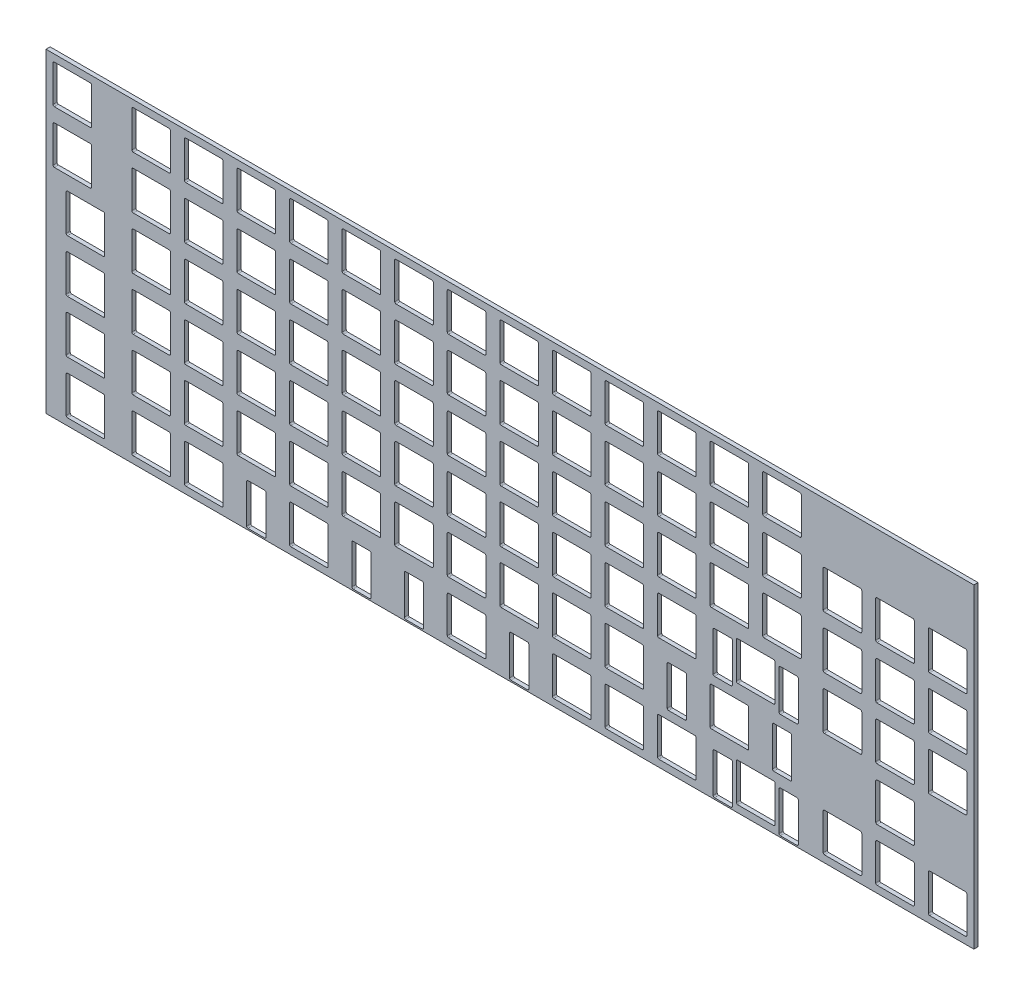
from build123d import *

# Parameters (mm, degrees)
MODEL_W             = 336.2325
MODEL_H             = 114.3
BOSS_EXTRUDE1_DEPTH = 1.5


with BuildPart() as part:
    # Model → Boss-Extrude1 (new body)
    with BuildSketch(Plane.XY):
        with Locations((168.11625, -57.15)):
            Rectangle(MODEL_W, MODEL_H)
        with BuildLine():
            Line((3.025, -2.525), (16.025, -2.525))
            ThreePointArc((16.025, -2.525), (16.378553391, -2.671446609), (16.525, -3.025))
            Line((16.525, -3.025), (16.525, -16.025))
            ThreePointArc((16.525, -16.025), (16.378553391, -16.378553391), (16.025, -16.525))
            Line((16.025, -16.525), (3.025, -16.525))
            ThreePointArc((3.025, -16.525), (2.671446609, -16.378553391), (2.525, -16.025))
            Line((2.525, -16.025), (2.525, -3.025))
            ThreePointArc((2.525, -3.025), (2.671446609, -2.671446609), (3.025, -2.525))
        make_face(mode=Mode.SUBTRACT)
        with BuildLine():
            Line((31.6, -2.525), (44.6, -2.525))
            ThreePointArc((44.6, -2.525), (44.953553391, -2.671446609), (45.1, -3.025))
            Line((45.1, -3.025), (45.1, -16.025))
            ThreePointArc((45.1, -16.025), (44.953553391, -16.378553391), (44.6, -16.525))
            Line((44.6, -16.525), (31.6, -16.525))
            ThreePointArc((31.6, -16.525), (31.246446609, -16.378553391), (31.1, -16.025))
            Line((31.1, -16.025), (31.1, -3.025))
            ThreePointArc((31.1, -3.025), (31.246446609, -2.671446609), (31.6, -2.525))
        make_face(mode=Mode.SUBTRACT)
        with BuildLine():
            Line((50.65, -2.525), (63.65, -2.525))
            ThreePointArc((63.65, -2.525), (64.003553391, -2.671446609), (64.15, -3.025))
            Line((64.15, -3.025), (64.15, -16.025))
            ThreePointArc((64.15, -16.025), (64.003553391, -16.378553391), (63.65, -16.525))
            Line((63.65, -16.525), (50.65, -16.525))
            ThreePointArc((50.65, -16.525), (50.296446609, -16.378553391), (50.15, -16.025))
            Line((50.15, -16.025), (50.15, -3.025))
            ThreePointArc((50.15, -3.025), (50.296446609, -2.671446609), (50.65, -2.525))
        make_face(mode=Mode.SUBTRACT)
        with BuildLine():
            Line((69.7, -2.525), (82.7, -2.525))
            ThreePointArc((82.7, -2.525), (83.053553391, -2.671446609), (83.2, -3.025))
            Line((83.2, -3.025), (83.2, -16.025))
            ThreePointArc((83.2, -16.025), (83.053553391, -16.378553391), (82.7, -16.525))
            Line((82.7, -16.525), (69.7, -16.525))
            ThreePointArc((69.7, -16.525), (69.346446609, -16.378553391), (69.2, -16.025))
            Line((69.2, -16.025), (69.2, -3.025))
            ThreePointArc((69.2, -3.025), (69.346446609, -2.671446609), (69.7, -2.525))
        make_face(mode=Mode.SUBTRACT)
        with BuildLine():
            Line((88.75, -2.525), (101.75, -2.525))
            ThreePointArc((101.75, -2.525), (102.103553391, -2.671446609), (102.25, -3.025))
            Line((102.25, -3.025), (102.25, -16.025))
            ThreePointArc((102.25, -16.025), (102.103553391, -16.378553391), (101.75, -16.525))
            Line((101.75, -16.525), (88.75, -16.525))
            ThreePointArc((88.75, -16.525), (88.396446609, -16.378553391), (88.25, -16.025))
            Line((88.25, -16.025), (88.25, -3.025))
            ThreePointArc((88.25, -3.025), (88.396446609, -2.671446609), (88.75, -2.525))
        make_face(mode=Mode.SUBTRACT)
        with BuildLine():
            Line((107.8, -2.525), (120.8, -2.525))
            ThreePointArc((120.8, -2.525), (121.153553391, -2.671446609), (121.3, -3.025))
            Line((121.3, -3.025), (121.3, -16.025))
            ThreePointArc((121.3, -16.025), (121.153553391, -16.378553391), (120.8, -16.525))
            Line((120.8, -16.525), (107.8, -16.525))
            ThreePointArc((107.8, -16.525), (107.446446609, -16.378553391), (107.3, -16.025))
            Line((107.3, -16.025), (107.3, -3.025))
            ThreePointArc((107.3, -3.025), (107.446446609, -2.671446609), (107.8, -2.525))
        make_face(mode=Mode.SUBTRACT)
        with BuildLine():
            Line((126.85, -2.525), (139.85, -2.525))
            ThreePointArc((139.85, -2.525), (140.203553391, -2.671446609), (140.35, -3.025))
            Line((140.35, -3.025), (140.35, -16.025))
            ThreePointArc((140.35, -16.025), (140.203553391, -16.378553391), (139.85, -16.525))
            Line((139.85, -16.525), (126.85, -16.525))
            ThreePointArc((126.85, -16.525), (126.496446609, -16.378553391), (126.35, -16.025))
            Line((126.35, -16.025), (126.35, -3.025))
            ThreePointArc((126.35, -3.025), (126.496446609, -2.671446609), (126.85, -2.525))
        make_face(mode=Mode.SUBTRACT)
        with BuildLine():
            Line((145.9, -2.525), (158.9, -2.525))
            ThreePointArc((158.9, -2.525), (159.253553391, -2.671446609), (159.4, -3.025))
            Line((159.4, -3.025), (159.4, -16.025))
            ThreePointArc((159.4, -16.025), (159.253553391, -16.378553391), (158.9, -16.525))
            Line((158.9, -16.525), (145.9, -16.525))
            ThreePointArc((145.9, -16.525), (145.546446609, -16.378553391), (145.4, -16.025))
            Line((145.4, -16.025), (145.4, -3.025))
            ThreePointArc((145.4, -3.025), (145.546446609, -2.671446609), (145.9, -2.525))
        make_face(mode=Mode.SUBTRACT)
        with BuildLine():
            Line((164.95, -2.525), (177.95, -2.525))
            ThreePointArc((177.95, -2.525), (178.303553391, -2.671446609), (178.45, -3.025))
            Line((178.45, -3.025), (178.45, -16.025))
            ThreePointArc((178.45, -16.025), (178.303553391, -16.378553391), (177.95, -16.525))
            Line((177.95, -16.525), (164.95, -16.525))
            ThreePointArc((164.95, -16.525), (164.596446609, -16.378553391), (164.45, -16.025))
            Line((164.45, -16.025), (164.45, -3.025))
            ThreePointArc((164.45, -3.025), (164.596446609, -2.671446609), (164.95, -2.525))
        make_face(mode=Mode.SUBTRACT)
        with BuildLine():
            Line((184, -2.525), (197, -2.525))
            ThreePointArc((197, -2.525), (197.353553391, -2.671446609), (197.5, -3.025))
            Line((197.5, -3.025), (197.5, -16.025))
            ThreePointArc((197.5, -16.025), (197.353553391, -16.378553391), (197, -16.525))
            Line((197, -16.525), (184, -16.525))
            ThreePointArc((184, -16.525), (183.646446609, -16.378553391), (183.5, -16.025))
            Line((183.5, -16.025), (183.5, -3.025))
            ThreePointArc((183.5, -3.025), (183.646446609, -2.671446609), (184, -2.525))
        make_face(mode=Mode.SUBTRACT)
        with BuildLine():
            Line((203.05, -2.525), (216.05, -2.525))
            ThreePointArc((216.05, -2.525), (216.403553391, -2.671446609), (216.55, -3.025))
            Line((216.55, -3.025), (216.55, -16.025))
            ThreePointArc((216.55, -16.025), (216.403553391, -16.378553391), (216.05, -16.525))
            Line((216.05, -16.525), (203.05, -16.525))
            ThreePointArc((203.05, -16.525), (202.696446609, -16.378553391), (202.55, -16.025))
            Line((202.55, -16.025), (202.55, -3.025))
            ThreePointArc((202.55, -3.025), (202.696446609, -2.671446609), (203.05, -2.525))
        make_face(mode=Mode.SUBTRACT)
        with BuildLine():
            Line((222.1, -2.525), (235.1, -2.525))
            ThreePointArc((235.1, -2.525), (235.453553391, -2.671446609), (235.6, -3.025))
            Line((235.6, -3.025), (235.6, -16.025))
            ThreePointArc((235.6, -16.025), (235.453553391, -16.378553391), (235.1, -16.525))
            Line((235.1, -16.525), (222.1, -16.525))
            ThreePointArc((222.1, -16.525), (221.746446609, -16.378553391), (221.6, -16.025))
            Line((221.6, -16.025), (221.6, -3.025))
            ThreePointArc((221.6, -3.025), (221.746446609, -2.671446609), (222.1, -2.525))
        make_face(mode=Mode.SUBTRACT)
        with BuildLine():
            Line((241.15, -2.525), (254.15, -2.525))
            ThreePointArc((254.15, -2.525), (254.503553391, -2.671446609), (254.65, -3.025))
            Line((254.65, -3.025), (254.65, -16.025))
            ThreePointArc((254.65, -16.025), (254.503553391, -16.378553391), (254.15, -16.525))
            Line((254.15, -16.525), (241.15, -16.525))
            ThreePointArc((241.15, -16.525), (240.796446609, -16.378553391), (240.65, -16.025))
            Line((240.65, -16.025), (240.65, -3.025))
            ThreePointArc((240.65, -3.025), (240.796446609, -2.671446609), (241.15, -2.525))
        make_face(mode=Mode.SUBTRACT)
        with BuildLine():
            Line((260.2, -2.525), (273.2, -2.525))
            ThreePointArc((273.2, -2.525), (273.553553391, -2.671446609), (273.7, -3.025))
            Line((273.7, -3.025), (273.7, -16.025))
            ThreePointArc((273.7, -16.025), (273.553553391, -16.378553391), (273.2, -16.525))
            Line((273.2, -16.525), (260.2, -16.525))
            ThreePointArc((260.2, -16.525), (259.846446609, -16.378553391), (259.7, -16.025))
            Line((259.7, -16.025), (259.7, -3.025))
            ThreePointArc((259.7, -3.025), (259.846446609, -2.671446609), (260.2, -2.525))
        make_face(mode=Mode.SUBTRACT)
        with BuildLine():
            Line((3.025, -21.575), (16.025, -21.575))
            ThreePointArc((16.025, -21.575), (16.378553391, -21.721446609), (16.525, -22.075))
            Line((16.525, -22.075), (16.525, -35.075))
            ThreePointArc((16.525, -35.075), (16.378553391, -35.428553391), (16.025, -35.575))
            Line((16.025, -35.575), (3.025, -35.575))
            ThreePointArc((3.025, -35.575), (2.671446609, -35.428553391), (2.525, -35.075))
            Line((2.525, -35.075), (2.525, -22.075))
            ThreePointArc((2.525, -22.075), (2.671446609, -21.721446609), (3.025, -21.575))
        make_face(mode=Mode.SUBTRACT)
        with BuildLine():
            Line((31.6, -21.575), (44.6, -21.575))
            ThreePointArc((44.6, -21.575), (44.953553391, -21.721446609), (45.1, -22.075))
            Line((45.1, -22.075), (45.1, -35.075))
            ThreePointArc((45.1, -35.075), (44.953553391, -35.428553391), (44.6, -35.575))
            Line((44.6, -35.575), (31.6, -35.575))
            ThreePointArc((31.6, -35.575), (31.246446609, -35.428553391), (31.1, -35.075))
            Line((31.1, -35.075), (31.1, -22.075))
            ThreePointArc((31.1, -22.075), (31.246446609, -21.721446609), (31.6, -21.575))
        make_face(mode=Mode.SUBTRACT)
        with BuildLine():
            Line((50.65, -21.575), (63.65, -21.575))
            ThreePointArc((63.65, -21.575), (64.003553391, -21.721446609), (64.15, -22.075))
            Line((64.15, -22.075), (64.15, -35.075))
            ThreePointArc((64.15, -35.075), (64.003553391, -35.428553391), (63.65, -35.575))
            Line((63.65, -35.575), (50.65, -35.575))
            ThreePointArc((50.65, -35.575), (50.296446609, -35.428553391), (50.15, -35.075))
            Line((50.15, -35.075), (50.15, -22.075))
            ThreePointArc((50.15, -22.075), (50.296446609, -21.721446609), (50.65, -21.575))
        make_face(mode=Mode.SUBTRACT)
        with BuildLine():
            Line((69.7, -21.575), (82.7, -21.575))
            ThreePointArc((82.7, -21.575), (83.053553391, -21.721446609), (83.2, -22.075))
            Line((83.2, -22.075), (83.2, -35.075))
            ThreePointArc((83.2, -35.075), (83.053553391, -35.428553391), (82.7, -35.575))
            Line((82.7, -35.575), (69.7, -35.575))
            ThreePointArc((69.7, -35.575), (69.346446609, -35.428553391), (69.2, -35.075))
            Line((69.2, -35.075), (69.2, -22.075))
            ThreePointArc((69.2, -22.075), (69.346446609, -21.721446609), (69.7, -21.575))
        make_face(mode=Mode.SUBTRACT)
        with BuildLine():
            Line((88.75, -21.575), (101.75, -21.575))
            ThreePointArc((101.75, -21.575), (102.103553391, -21.721446609), (102.25, -22.075))
            Line((102.25, -22.075), (102.25, -35.075))
            ThreePointArc((102.25, -35.075), (102.103553391, -35.428553391), (101.75, -35.575))
            Line((101.75, -35.575), (88.75, -35.575))
            ThreePointArc((88.75, -35.575), (88.396446609, -35.428553391), (88.25, -35.075))
            Line((88.25, -35.075), (88.25, -22.075))
            ThreePointArc((88.25, -22.075), (88.396446609, -21.721446609), (88.75, -21.575))
        make_face(mode=Mode.SUBTRACT)
        with BuildLine():
            Line((107.8, -21.575), (120.8, -21.575))
            ThreePointArc((120.8, -21.575), (121.153553391, -21.721446609), (121.3, -22.075))
            Line((121.3, -22.075), (121.3, -35.075))
            ThreePointArc((121.3, -35.075), (121.153553391, -35.428553391), (120.8, -35.575))
            Line((120.8, -35.575), (107.8, -35.575))
            ThreePointArc((107.8, -35.575), (107.446446609, -35.428553391), (107.3, -35.075))
            Line((107.3, -35.075), (107.3, -22.075))
            ThreePointArc((107.3, -22.075), (107.446446609, -21.721446609), (107.8, -21.575))
        make_face(mode=Mode.SUBTRACT)
        with BuildLine():
            Line((126.85, -21.575), (139.85, -21.575))
            ThreePointArc((139.85, -21.575), (140.203553391, -21.721446609), (140.35, -22.075))
            Line((140.35, -22.075), (140.35, -35.075))
            ThreePointArc((140.35, -35.075), (140.203553391, -35.428553391), (139.85, -35.575))
            Line((139.85, -35.575), (126.85, -35.575))
            ThreePointArc((126.85, -35.575), (126.496446609, -35.428553391), (126.35, -35.075))
            Line((126.35, -35.075), (126.35, -22.075))
            ThreePointArc((126.35, -22.075), (126.496446609, -21.721446609), (126.85, -21.575))
        make_face(mode=Mode.SUBTRACT)
        with BuildLine():
            Line((145.9, -21.575), (158.9, -21.575))
            ThreePointArc((158.9, -21.575), (159.253553391, -21.721446609), (159.4, -22.075))
            Line((159.4, -22.075), (159.4, -35.075))
            ThreePointArc((159.4, -35.075), (159.253553391, -35.428553391), (158.9, -35.575))
            Line((158.9, -35.575), (145.9, -35.575))
            ThreePointArc((145.9, -35.575), (145.546446609, -35.428553391), (145.4, -35.075))
            Line((145.4, -35.075), (145.4, -22.075))
            ThreePointArc((145.4, -22.075), (145.546446609, -21.721446609), (145.9, -21.575))
        make_face(mode=Mode.SUBTRACT)
        with BuildLine():
            Line((164.95, -21.575), (177.95, -21.575))
            ThreePointArc((177.95, -21.575), (178.303553391, -21.721446609), (178.45, -22.075))
            Line((178.45, -22.075), (178.45, -35.075))
            ThreePointArc((178.45, -35.075), (178.303553391, -35.428553391), (177.95, -35.575))
            Line((177.95, -35.575), (164.95, -35.575))
            ThreePointArc((164.95, -35.575), (164.596446609, -35.428553391), (164.45, -35.075))
            Line((164.45, -35.075), (164.45, -22.075))
            ThreePointArc((164.45, -22.075), (164.596446609, -21.721446609), (164.95, -21.575))
        make_face(mode=Mode.SUBTRACT)
        with BuildLine():
            Line((184, -21.575), (197, -21.575))
            ThreePointArc((197, -21.575), (197.353553391, -21.721446609), (197.5, -22.075))
            Line((197.5, -22.075), (197.5, -35.075))
            ThreePointArc((197.5, -35.075), (197.353553391, -35.428553391), (197, -35.575))
            Line((197, -35.575), (184, -35.575))
            ThreePointArc((184, -35.575), (183.646446609, -35.428553391), (183.5, -35.075))
            Line((183.5, -35.075), (183.5, -22.075))
            ThreePointArc((183.5, -22.075), (183.646446609, -21.721446609), (184, -21.575))
        make_face(mode=Mode.SUBTRACT)
        with BuildLine():
            Line((203.05, -21.575), (216.05, -21.575))
            ThreePointArc((216.05, -21.575), (216.403553391, -21.721446609), (216.55, -22.075))
            Line((216.55, -22.075), (216.55, -35.075))
            ThreePointArc((216.55, -35.075), (216.403553391, -35.428553391), (216.05, -35.575))
            Line((216.05, -35.575), (203.05, -35.575))
            ThreePointArc((203.05, -35.575), (202.696446609, -35.428553391), (202.55, -35.075))
            Line((202.55, -35.075), (202.55, -22.075))
            ThreePointArc((202.55, -22.075), (202.696446609, -21.721446609), (203.05, -21.575))
        make_face(mode=Mode.SUBTRACT)
        with BuildLine():
            Line((222.1, -21.575), (235.1, -21.575))
            ThreePointArc((235.1, -21.575), (235.453553391, -21.721446609), (235.6, -22.075))
            Line((235.6, -22.075), (235.6, -35.075))
            ThreePointArc((235.6, -35.075), (235.453553391, -35.428553391), (235.1, -35.575))
            Line((235.1, -35.575), (222.1, -35.575))
            ThreePointArc((222.1, -35.575), (221.746446609, -35.428553391), (221.6, -35.075))
            Line((221.6, -35.075), (221.6, -22.075))
            ThreePointArc((221.6, -22.075), (221.746446609, -21.721446609), (222.1, -21.575))
        make_face(mode=Mode.SUBTRACT)
        with BuildLine():
            Line((241.15, -21.575), (254.15, -21.575))
            ThreePointArc((254.15, -21.575), (254.503553391, -21.721446609), (254.65, -22.075))
            Line((254.65, -22.075), (254.65, -35.075))
            ThreePointArc((254.65, -35.075), (254.503553391, -35.428553391), (254.15, -35.575))
            Line((254.15, -35.575), (241.15, -35.575))
            ThreePointArc((241.15, -35.575), (240.796446609, -35.428553391), (240.65, -35.075))
            Line((240.65, -35.075), (240.65, -22.075))
            ThreePointArc((240.65, -22.075), (240.796446609, -21.721446609), (241.15, -21.575))
        make_face(mode=Mode.SUBTRACT)
        with BuildLine():
            Line((260.2, -21.575), (273.2, -21.575))
            ThreePointArc((273.2, -21.575), (273.553553391, -21.721446609), (273.7, -22.075))
            Line((273.7, -22.075), (273.7, -35.075))
            ThreePointArc((273.7, -35.075), (273.553553391, -35.428553391), (273.2, -35.575))
            Line((273.2, -35.575), (260.2, -35.575))
            ThreePointArc((260.2, -35.575), (259.846446609, -35.428553391), (259.7, -35.075))
            Line((259.7, -35.075), (259.7, -22.075))
            ThreePointArc((259.7, -22.075), (259.846446609, -21.721446609), (260.2, -21.575))
        make_face(mode=Mode.SUBTRACT)
        with BuildLine():
            Line((282.1075, -21.575), (295.1075, -21.575))
            ThreePointArc((295.1075, -21.575), (295.461053391, -21.721446609), (295.6075, -22.075))
            Line((295.6075, -22.075), (295.6075, -35.075))
            ThreePointArc((295.6075, -35.075), (295.461053391, -35.428553391), (295.1075, -35.575))
            Line((295.1075, -35.575), (282.1075, -35.575))
            ThreePointArc((282.1075, -35.575), (281.753946609, -35.428553391), (281.6075, -35.075))
            Line((281.6075, -35.075), (281.6075, -22.075))
            ThreePointArc((281.6075, -22.075), (281.753946609, -21.721446609), (282.1075, -21.575))
        make_face(mode=Mode.SUBTRACT)
        with BuildLine():
            Line((301.1575, -21.575), (314.1575, -21.575))
            ThreePointArc((314.1575, -21.575), (314.511053391, -21.721446609), (314.6575, -22.075))
            Line((314.6575, -22.075), (314.6575, -35.075))
            ThreePointArc((314.6575, -35.075), (314.511053391, -35.428553391), (314.1575, -35.575))
            Line((314.1575, -35.575), (301.1575, -35.575))
            ThreePointArc((301.1575, -35.575), (300.803946609, -35.428553391), (300.6575, -35.075))
            Line((300.6575, -35.075), (300.6575, -22.075))
            ThreePointArc((300.6575, -22.075), (300.803946609, -21.721446609), (301.1575, -21.575))
        make_face(mode=Mode.SUBTRACT)
        with BuildLine():
            Line((320.2075, -21.575), (333.2075, -21.575))
            ThreePointArc((333.2075, -21.575), (333.561053391, -21.721446609), (333.7075, -22.075))
            Line((333.7075, -22.075), (333.7075, -35.075))
            ThreePointArc((333.7075, -35.075), (333.561053391, -35.428553391), (333.2075, -35.575))
            Line((333.2075, -35.575), (320.2075, -35.575))
            ThreePointArc((320.2075, -35.575), (319.853946609, -35.428553391), (319.7075, -35.075))
            Line((319.7075, -35.075), (319.7075, -22.075))
            ThreePointArc((319.7075, -22.075), (319.853946609, -21.721446609), (320.2075, -21.575))
        make_face(mode=Mode.SUBTRACT)
        with BuildLine():
            Line((7.7875, -40.625), (20.7875, -40.625))
            ThreePointArc((20.7875, -40.625), (21.141053391, -40.771446609), (21.2875, -41.125))
            Line((21.2875, -41.125), (21.2875, -54.125))
            ThreePointArc((21.2875, -54.125), (21.141053391, -54.478553391), (20.7875, -54.625))
            Line((20.7875, -54.625), (7.7875, -54.625))
            ThreePointArc((7.7875, -54.625), (7.433946609, -54.478553391), (7.2875, -54.125))
            Line((7.2875, -54.125), (7.2875, -41.125))
            ThreePointArc((7.2875, -41.125), (7.433946609, -40.771446609), (7.7875, -40.625))
        make_face(mode=Mode.SUBTRACT)
        with BuildLine():
            Line((31.6, -40.625), (44.6, -40.625))
            ThreePointArc((44.6, -40.625), (44.953553391, -40.771446609), (45.1, -41.125))
            Line((45.1, -41.125), (45.1, -54.125))
            ThreePointArc((45.1, -54.125), (44.953553391, -54.478553391), (44.6, -54.625))
            Line((44.6, -54.625), (31.6, -54.625))
            ThreePointArc((31.6, -54.625), (31.246446609, -54.478553391), (31.1, -54.125))
            Line((31.1, -54.125), (31.1, -41.125))
            ThreePointArc((31.1, -41.125), (31.246446609, -40.771446609), (31.6, -40.625))
        make_face(mode=Mode.SUBTRACT)
        with BuildLine():
            Line((50.65, -40.625), (63.65, -40.625))
            ThreePointArc((63.65, -40.625), (64.003553391, -40.771446609), (64.15, -41.125))
            Line((64.15, -41.125), (64.15, -54.125))
            ThreePointArc((64.15, -54.125), (64.003553391, -54.478553391), (63.65, -54.625))
            Line((63.65, -54.625), (50.65, -54.625))
            ThreePointArc((50.65, -54.625), (50.296446609, -54.478553391), (50.15, -54.125))
            Line((50.15, -54.125), (50.15, -41.125))
            ThreePointArc((50.15, -41.125), (50.296446609, -40.771446609), (50.65, -40.625))
        make_face(mode=Mode.SUBTRACT)
        with BuildLine():
            Line((69.7, -40.625), (82.7, -40.625))
            ThreePointArc((82.7, -40.625), (83.053553391, -40.771446609), (83.2, -41.125))
            Line((83.2, -41.125), (83.2, -54.125))
            ThreePointArc((83.2, -54.125), (83.053553391, -54.478553391), (82.7, -54.625))
            Line((82.7, -54.625), (69.7, -54.625))
            ThreePointArc((69.7, -54.625), (69.346446609, -54.478553391), (69.2, -54.125))
            Line((69.2, -54.125), (69.2, -41.125))
            ThreePointArc((69.2, -41.125), (69.346446609, -40.771446609), (69.7, -40.625))
        make_face(mode=Mode.SUBTRACT)
        with BuildLine():
            Line((88.75, -40.625), (101.75, -40.625))
            ThreePointArc((101.75, -40.625), (102.103553391, -40.771446609), (102.25, -41.125))
            Line((102.25, -41.125), (102.25, -54.125))
            ThreePointArc((102.25, -54.125), (102.103553391, -54.478553391), (101.75, -54.625))
            Line((101.75, -54.625), (88.75, -54.625))
            ThreePointArc((88.75, -54.625), (88.396446609, -54.478553391), (88.25, -54.125))
            Line((88.25, -54.125), (88.25, -41.125))
            ThreePointArc((88.25, -41.125), (88.396446609, -40.771446609), (88.75, -40.625))
        make_face(mode=Mode.SUBTRACT)
        with BuildLine():
            Line((107.8, -40.625), (120.8, -40.625))
            ThreePointArc((120.8, -40.625), (121.153553391, -40.771446609), (121.3, -41.125))
            Line((121.3, -41.125), (121.3, -54.125))
            ThreePointArc((121.3, -54.125), (121.153553391, -54.478553391), (120.8, -54.625))
            Line((120.8, -54.625), (107.8, -54.625))
            ThreePointArc((107.8, -54.625), (107.446446609, -54.478553391), (107.3, -54.125))
            Line((107.3, -54.125), (107.3, -41.125))
            ThreePointArc((107.3, -41.125), (107.446446609, -40.771446609), (107.8, -40.625))
        make_face(mode=Mode.SUBTRACT)
        with BuildLine():
            Line((126.85, -40.625), (139.85, -40.625))
            ThreePointArc((139.85, -40.625), (140.203553391, -40.771446609), (140.35, -41.125))
            Line((140.35, -41.125), (140.35, -54.125))
            ThreePointArc((140.35, -54.125), (140.203553391, -54.478553391), (139.85, -54.625))
            Line((139.85, -54.625), (126.85, -54.625))
            ThreePointArc((126.85, -54.625), (126.496446609, -54.478553391), (126.35, -54.125))
            Line((126.35, -54.125), (126.35, -41.125))
            ThreePointArc((126.35, -41.125), (126.496446609, -40.771446609), (126.85, -40.625))
        make_face(mode=Mode.SUBTRACT)
        with BuildLine():
            Line((145.9, -40.625), (158.9, -40.625))
            ThreePointArc((158.9, -40.625), (159.253553391, -40.771446609), (159.4, -41.125))
            Line((159.4, -41.125), (159.4, -54.125))
            ThreePointArc((159.4, -54.125), (159.253553391, -54.478553391), (158.9, -54.625))
            Line((158.9, -54.625), (145.9, -54.625))
            ThreePointArc((145.9, -54.625), (145.546446609, -54.478553391), (145.4, -54.125))
            Line((145.4, -54.125), (145.4, -41.125))
            ThreePointArc((145.4, -41.125), (145.546446609, -40.771446609), (145.9, -40.625))
        make_face(mode=Mode.SUBTRACT)
        with BuildLine():
            Line((164.95, -40.625), (177.95, -40.625))
            ThreePointArc((177.95, -40.625), (178.303553391, -40.771446609), (178.45, -41.125))
            Line((178.45, -41.125), (178.45, -54.125))
            ThreePointArc((178.45, -54.125), (178.303553391, -54.478553391), (177.95, -54.625))
            Line((177.95, -54.625), (164.95, -54.625))
            ThreePointArc((164.95, -54.625), (164.596446609, -54.478553391), (164.45, -54.125))
            Line((164.45, -54.125), (164.45, -41.125))
            ThreePointArc((164.45, -41.125), (164.596446609, -40.771446609), (164.95, -40.625))
        make_face(mode=Mode.SUBTRACT)
        with BuildLine():
            Line((184, -40.625), (197, -40.625))
            ThreePointArc((197, -40.625), (197.353553391, -40.771446609), (197.5, -41.125))
            Line((197.5, -41.125), (197.5, -54.125))
            ThreePointArc((197.5, -54.125), (197.353553391, -54.478553391), (197, -54.625))
            Line((197, -54.625), (184, -54.625))
            ThreePointArc((184, -54.625), (183.646446609, -54.478553391), (183.5, -54.125))
            Line((183.5, -54.125), (183.5, -41.125))
            ThreePointArc((183.5, -41.125), (183.646446609, -40.771446609), (184, -40.625))
        make_face(mode=Mode.SUBTRACT)
        with BuildLine():
            Line((203.05, -40.625), (216.05, -40.625))
            ThreePointArc((216.05, -40.625), (216.403553391, -40.771446609), (216.55, -41.125))
            Line((216.55, -41.125), (216.55, -54.125))
            ThreePointArc((216.55, -54.125), (216.403553391, -54.478553391), (216.05, -54.625))
            Line((216.05, -54.625), (203.05, -54.625))
            ThreePointArc((203.05, -54.625), (202.696446609, -54.478553391), (202.55, -54.125))
            Line((202.55, -54.125), (202.55, -41.125))
            ThreePointArc((202.55, -41.125), (202.696446609, -40.771446609), (203.05, -40.625))
        make_face(mode=Mode.SUBTRACT)
        with BuildLine():
            Line((222.1, -40.625), (235.1, -40.625))
            ThreePointArc((235.1, -40.625), (235.453553391, -40.771446609), (235.6, -41.125))
            Line((235.6, -41.125), (235.6, -54.125))
            ThreePointArc((235.6, -54.125), (235.453553391, -54.478553391), (235.1, -54.625))
            Line((235.1, -54.625), (222.1, -54.625))
            ThreePointArc((222.1, -54.625), (221.746446609, -54.478553391), (221.6, -54.125))
            Line((221.6, -54.125), (221.6, -41.125))
            ThreePointArc((221.6, -41.125), (221.746446609, -40.771446609), (222.1, -40.625))
        make_face(mode=Mode.SUBTRACT)
        with BuildLine():
            Line((241.15, -40.625), (254.15, -40.625))
            ThreePointArc((254.15, -40.625), (254.503553391, -40.771446609), (254.65, -41.125))
            Line((254.65, -41.125), (254.65, -54.125))
            ThreePointArc((254.65, -54.125), (254.503553391, -54.478553391), (254.15, -54.625))
            Line((254.15, -54.625), (241.15, -54.625))
            ThreePointArc((241.15, -54.625), (240.796446609, -54.478553391), (240.65, -54.125))
            Line((240.65, -54.125), (240.65, -41.125))
            ThreePointArc((240.65, -41.125), (240.796446609, -40.771446609), (241.15, -40.625))
        make_face(mode=Mode.SUBTRACT)
        with BuildLine():
            Line((260.2, -40.625), (273.2, -40.625))
            ThreePointArc((273.2, -40.625), (273.553553391, -40.771446609), (273.7, -41.125))
            Line((273.7, -41.125), (273.7, -54.125))
            ThreePointArc((273.7, -54.125), (273.553553391, -54.478553391), (273.2, -54.625))
            Line((273.2, -54.625), (260.2, -54.625))
            ThreePointArc((260.2, -54.625), (259.846446609, -54.478553391), (259.7, -54.125))
            Line((259.7, -54.125), (259.7, -41.125))
            ThreePointArc((259.7, -41.125), (259.846446609, -40.771446609), (260.2, -40.625))
        make_face(mode=Mode.SUBTRACT)
        with BuildLine():
            Line((282.1075, -40.625), (295.1075, -40.625))
            ThreePointArc((295.1075, -40.625), (295.461053391, -40.771446609), (295.6075, -41.125))
            Line((295.6075, -41.125), (295.6075, -54.125))
            ThreePointArc((295.6075, -54.125), (295.461053391, -54.478553391), (295.1075, -54.625))
            Line((295.1075, -54.625), (282.1075, -54.625))
            ThreePointArc((282.1075, -54.625), (281.753946609, -54.478553391), (281.6075, -54.125))
            Line((281.6075, -54.125), (281.6075, -41.125))
            ThreePointArc((281.6075, -41.125), (281.753946609, -40.771446609), (282.1075, -40.625))
        make_face(mode=Mode.SUBTRACT)
        with BuildLine():
            Line((301.1575, -40.625), (314.1575, -40.625))
            ThreePointArc((314.1575, -40.625), (314.511053391, -40.771446609), (314.6575, -41.125))
            Line((314.6575, -41.125), (314.6575, -54.125))
            ThreePointArc((314.6575, -54.125), (314.511053391, -54.478553391), (314.1575, -54.625))
            Line((314.1575, -54.625), (301.1575, -54.625))
            ThreePointArc((301.1575, -54.625), (300.803946609, -54.478553391), (300.6575, -54.125))
            Line((300.6575, -54.125), (300.6575, -41.125))
            ThreePointArc((300.6575, -41.125), (300.803946609, -40.771446609), (301.1575, -40.625))
        make_face(mode=Mode.SUBTRACT)
        with BuildLine():
            Line((320.2075, -40.625), (333.2075, -40.625))
            ThreePointArc((333.2075, -40.625), (333.561053391, -40.771446609), (333.7075, -41.125))
            Line((333.7075, -41.125), (333.7075, -54.125))
            ThreePointArc((333.7075, -54.125), (333.561053391, -54.478553391), (333.2075, -54.625))
            Line((333.2075, -54.625), (320.2075, -54.625))
            ThreePointArc((320.2075, -54.625), (319.853946609, -54.478553391), (319.7075, -54.125))
            Line((319.7075, -54.125), (319.7075, -41.125))
            ThreePointArc((319.7075, -41.125), (319.853946609, -40.771446609), (320.2075, -40.625))
        make_face(mode=Mode.SUBTRACT)
        with BuildLine():
            Line((7.7875, -59.675), (20.7875, -59.675))
            ThreePointArc((20.7875, -59.675), (21.141053391, -59.821446609), (21.2875, -60.175))
            Line((21.2875, -60.175), (21.2875, -73.175))
            ThreePointArc((21.2875, -73.175), (21.141053391, -73.528553391), (20.7875, -73.675))
            Line((20.7875, -73.675), (7.7875, -73.675))
            ThreePointArc((7.7875, -73.675), (7.433946609, -73.528553391), (7.2875, -73.175))
            Line((7.2875, -73.175), (7.2875, -60.175))
            ThreePointArc((7.2875, -60.175), (7.433946609, -59.821446609), (7.7875, -59.675))
        make_face(mode=Mode.SUBTRACT)
        with BuildLine():
            Line((31.6, -59.675), (44.6, -59.675))
            ThreePointArc((44.6, -59.675), (44.953553391, -59.821446609), (45.1, -60.175))
            Line((45.1, -60.175), (45.1, -73.175))
            ThreePointArc((45.1, -73.175), (44.953553391, -73.528553391), (44.6, -73.675))
            Line((44.6, -73.675), (31.6, -73.675))
            ThreePointArc((31.6, -73.675), (31.246446609, -73.528553391), (31.1, -73.175))
            Line((31.1, -73.175), (31.1, -60.175))
            ThreePointArc((31.1, -60.175), (31.246446609, -59.821446609), (31.6, -59.675))
        make_face(mode=Mode.SUBTRACT)
        with BuildLine():
            Line((50.65, -59.675), (63.65, -59.675))
            ThreePointArc((63.65, -59.675), (64.003553391, -59.821446609), (64.15, -60.175))
            Line((64.15, -60.175), (64.15, -73.175))
            ThreePointArc((64.15, -73.175), (64.003553391, -73.528553391), (63.65, -73.675))
            Line((63.65, -73.675), (50.65, -73.675))
            ThreePointArc((50.65, -73.675), (50.296446609, -73.528553391), (50.15, -73.175))
            Line((50.15, -73.175), (50.15, -60.175))
            ThreePointArc((50.15, -60.175), (50.296446609, -59.821446609), (50.65, -59.675))
        make_face(mode=Mode.SUBTRACT)
        with BuildLine():
            Line((69.7, -59.675), (82.7, -59.675))
            ThreePointArc((82.7, -59.675), (83.053553391, -59.821446609), (83.2, -60.175))
            Line((83.2, -60.175), (83.2, -73.175))
            ThreePointArc((83.2, -73.175), (83.053553391, -73.528553391), (82.7, -73.675))
            Line((82.7, -73.675), (69.7, -73.675))
            ThreePointArc((69.7, -73.675), (69.346446609, -73.528553391), (69.2, -73.175))
            Line((69.2, -73.175), (69.2, -60.175))
            ThreePointArc((69.2, -60.175), (69.346446609, -59.821446609), (69.7, -59.675))
        make_face(mode=Mode.SUBTRACT)
        with BuildLine():
            Line((88.75, -59.675), (101.75, -59.675))
            ThreePointArc((101.75, -59.675), (102.103553391, -59.821446609), (102.25, -60.175))
            Line((102.25, -60.175), (102.25, -73.175))
            ThreePointArc((102.25, -73.175), (102.103553391, -73.528553391), (101.75, -73.675))
            Line((101.75, -73.675), (88.75, -73.675))
            ThreePointArc((88.75, -73.675), (88.396446609, -73.528553391), (88.25, -73.175))
            Line((88.25, -73.175), (88.25, -60.175))
            ThreePointArc((88.25, -60.175), (88.396446609, -59.821446609), (88.75, -59.675))
        make_face(mode=Mode.SUBTRACT)
        with BuildLine():
            Line((107.8, -59.675), (120.8, -59.675))
            ThreePointArc((120.8, -59.675), (121.153553391, -59.821446609), (121.3, -60.175))
            Line((121.3, -60.175), (121.3, -73.175))
            ThreePointArc((121.3, -73.175), (121.153553391, -73.528553391), (120.8, -73.675))
            Line((120.8, -73.675), (107.8, -73.675))
            ThreePointArc((107.8, -73.675), (107.446446609, -73.528553391), (107.3, -73.175))
            Line((107.3, -73.175), (107.3, -60.175))
            ThreePointArc((107.3, -60.175), (107.446446609, -59.821446609), (107.8, -59.675))
        make_face(mode=Mode.SUBTRACT)
        with BuildLine():
            Line((126.85, -59.675), (139.85, -59.675))
            ThreePointArc((139.85, -59.675), (140.203553391, -59.821446609), (140.35, -60.175))
            Line((140.35, -60.175), (140.35, -73.175))
            ThreePointArc((140.35, -73.175), (140.203553391, -73.528553391), (139.85, -73.675))
            Line((139.85, -73.675), (126.85, -73.675))
            ThreePointArc((126.85, -73.675), (126.496446609, -73.528553391), (126.35, -73.175))
            Line((126.35, -73.175), (126.35, -60.175))
            ThreePointArc((126.35, -60.175), (126.496446609, -59.821446609), (126.85, -59.675))
        make_face(mode=Mode.SUBTRACT)
        with BuildLine():
            Line((145.9, -59.675), (158.9, -59.675))
            ThreePointArc((158.9, -59.675), (159.253553391, -59.821446609), (159.4, -60.175))
            Line((159.4, -60.175), (159.4, -73.175))
            ThreePointArc((159.4, -73.175), (159.253553391, -73.528553391), (158.9, -73.675))
            Line((158.9, -73.675), (145.9, -73.675))
            ThreePointArc((145.9, -73.675), (145.546446609, -73.528553391), (145.4, -73.175))
            Line((145.4, -73.175), (145.4, -60.175))
            ThreePointArc((145.4, -60.175), (145.546446609, -59.821446609), (145.9, -59.675))
        make_face(mode=Mode.SUBTRACT)
        with BuildLine():
            Line((164.95, -59.675), (177.95, -59.675))
            ThreePointArc((177.95, -59.675), (178.303553391, -59.821446609), (178.45, -60.175))
            Line((178.45, -60.175), (178.45, -73.175))
            ThreePointArc((178.45, -73.175), (178.303553391, -73.528553391), (177.95, -73.675))
            Line((177.95, -73.675), (164.95, -73.675))
            ThreePointArc((164.95, -73.675), (164.596446609, -73.528553391), (164.45, -73.175))
            Line((164.45, -73.175), (164.45, -60.175))
            ThreePointArc((164.45, -60.175), (164.596446609, -59.821446609), (164.95, -59.675))
        make_face(mode=Mode.SUBTRACT)
        with BuildLine():
            Line((184, -59.675), (197, -59.675))
            ThreePointArc((197, -59.675), (197.353553391, -59.821446609), (197.5, -60.175))
            Line((197.5, -60.175), (197.5, -73.175))
            ThreePointArc((197.5, -73.175), (197.353553391, -73.528553391), (197, -73.675))
            Line((197, -73.675), (184, -73.675))
            ThreePointArc((184, -73.675), (183.646446609, -73.528553391), (183.5, -73.175))
            Line((183.5, -73.175), (183.5, -60.175))
            ThreePointArc((183.5, -60.175), (183.646446609, -59.821446609), (184, -59.675))
        make_face(mode=Mode.SUBTRACT)
        with BuildLine():
            Line((203.05, -59.675), (216.05, -59.675))
            ThreePointArc((216.05, -59.675), (216.403553391, -59.821446609), (216.55, -60.175))
            Line((216.55, -60.175), (216.55, -73.175))
            ThreePointArc((216.55, -73.175), (216.403553391, -73.528553391), (216.05, -73.675))
            Line((216.05, -73.675), (203.05, -73.675))
            ThreePointArc((203.05, -73.675), (202.696446609, -73.528553391), (202.55, -73.175))
            Line((202.55, -73.175), (202.55, -60.175))
            ThreePointArc((202.55, -60.175), (202.696446609, -59.821446609), (203.05, -59.675))
        make_face(mode=Mode.SUBTRACT)
        with BuildLine():
            Line((222.1, -59.675), (235.1, -59.675))
            ThreePointArc((235.1, -59.675), (235.453553391, -59.821446609), (235.6, -60.175))
            Line((235.6, -60.175), (235.6, -73.175))
            ThreePointArc((235.6, -73.175), (235.453553391, -73.528553391), (235.1, -73.675))
            Line((235.1, -73.675), (222.1, -73.675))
            ThreePointArc((222.1, -73.675), (221.746446609, -73.528553391), (221.6, -73.175))
            Line((221.6, -73.175), (221.6, -60.175))
            ThreePointArc((221.6, -60.175), (221.746446609, -59.821446609), (222.1, -59.675))
        make_face(mode=Mode.SUBTRACT)
        with BuildLine():
            Line((250.675, -59.675), (263.675, -59.675))
            ThreePointArc((263.675, -59.675), (264.028553391, -59.821446609), (264.175, -60.175))
            Line((264.175, -60.175), (264.175, -73.175))
            ThreePointArc((264.175, -73.175), (264.028553391, -73.528553391), (263.675, -73.675))
            Line((263.675, -73.675), (250.675, -73.675))
            ThreePointArc((250.675, -73.675), (250.321446609, -73.528553391), (250.175, -73.175))
            Line((250.175, -73.175), (250.175, -60.175))
            ThreePointArc((250.175, -60.175), (250.321446609, -59.821446609), (250.675, -59.675))
        make_face(mode=Mode.SUBTRACT)
        with BuildLine():
            Line((242.237, -60.675), (248.237, -60.675))
            ThreePointArc((248.237, -60.675), (248.590553391, -60.821446609), (248.737, -61.175))
            Line((248.737, -61.175), (248.737, -75.175))
            ThreePointArc((248.737, -75.175), (248.590553391, -75.528553391), (248.237, -75.675))
            Line((248.237, -75.675), (242.237, -75.675))
            ThreePointArc((242.237, -75.675), (241.883446609, -75.528553391), (241.737, -75.175))
            Line((241.737, -75.175), (241.737, -61.175))
            ThreePointArc((241.737, -61.175), (241.883446609, -60.821446609), (242.237, -60.675))
        make_face(mode=Mode.SUBTRACT)
        with BuildLine():
            Line((266.113, -60.675), (272.113, -60.675))
            ThreePointArc((272.113, -60.675), (272.466553391, -60.821446609), (272.613, -61.175))
            Line((272.613, -61.175), (272.613, -75.175))
            ThreePointArc((272.613, -75.175), (272.466553391, -75.528553391), (272.113, -75.675))
            Line((272.113, -75.675), (266.113, -75.675))
            ThreePointArc((266.113, -75.675), (265.759446609, -75.528553391), (265.613, -75.175))
            Line((265.613, -75.175), (265.613, -61.175))
            ThreePointArc((265.613, -61.175), (265.759446609, -60.821446609), (266.113, -60.675))
        make_face(mode=Mode.SUBTRACT)
        with BuildLine():
            Line((282.1075, -59.675), (295.1075, -59.675))
            ThreePointArc((295.1075, -59.675), (295.461053391, -59.821446609), (295.6075, -60.175))
            Line((295.6075, -60.175), (295.6075, -73.175))
            ThreePointArc((295.6075, -73.175), (295.461053391, -73.528553391), (295.1075, -73.675))
            Line((295.1075, -73.675), (282.1075, -73.675))
            ThreePointArc((282.1075, -73.675), (281.753946609, -73.528553391), (281.6075, -73.175))
            Line((281.6075, -73.175), (281.6075, -60.175))
            ThreePointArc((281.6075, -60.175), (281.753946609, -59.821446609), (282.1075, -59.675))
        make_face(mode=Mode.SUBTRACT)
        with BuildLine():
            Line((301.1575, -59.675), (314.1575, -59.675))
            ThreePointArc((314.1575, -59.675), (314.511053391, -59.821446609), (314.6575, -60.175))
            Line((314.6575, -60.175), (314.6575, -73.175))
            ThreePointArc((314.6575, -73.175), (314.511053391, -73.528553391), (314.1575, -73.675))
            Line((314.1575, -73.675), (301.1575, -73.675))
            ThreePointArc((301.1575, -73.675), (300.803946609, -73.528553391), (300.6575, -73.175))
            Line((300.6575, -73.175), (300.6575, -60.175))
            ThreePointArc((300.6575, -60.175), (300.803946609, -59.821446609), (301.1575, -59.675))
        make_face(mode=Mode.SUBTRACT)
        with BuildLine():
            Line((320.2075, -59.675), (333.2075, -59.675))
            ThreePointArc((333.2075, -59.675), (333.561053391, -59.821446609), (333.7075, -60.175))
            Line((333.7075, -60.175), (333.7075, -73.175))
            ThreePointArc((333.7075, -73.175), (333.561053391, -73.528553391), (333.2075, -73.675))
            Line((333.2075, -73.675), (320.2075, -73.675))
            ThreePointArc((320.2075, -73.675), (319.853946609, -73.528553391), (319.7075, -73.175))
            Line((319.7075, -73.175), (319.7075, -60.175))
            ThreePointArc((319.7075, -60.175), (319.853946609, -59.821446609), (320.2075, -59.675))
        make_face(mode=Mode.SUBTRACT)
        with BuildLine():
            Line((7.7875, -78.725), (20.7875, -78.725))
            ThreePointArc((20.7875, -78.725), (21.141053391, -78.871446609), (21.2875, -79.225))
            Line((21.2875, -79.225), (21.2875, -92.225))
            ThreePointArc((21.2875, -92.225), (21.141053391, -92.578553391), (20.7875, -92.725))
            Line((20.7875, -92.725), (7.7875, -92.725))
            ThreePointArc((7.7875, -92.725), (7.433946609, -92.578553391), (7.2875, -92.225))
            Line((7.2875, -92.225), (7.2875, -79.225))
            ThreePointArc((7.2875, -79.225), (7.433946609, -78.871446609), (7.7875, -78.725))
        make_face(mode=Mode.SUBTRACT)
        with BuildLine():
            Line((31.6, -78.725), (44.6, -78.725))
            ThreePointArc((44.6, -78.725), (44.953553391, -78.871446609), (45.1, -79.225))
            Line((45.1, -79.225), (45.1, -92.225))
            ThreePointArc((45.1, -92.225), (44.953553391, -92.578553391), (44.6, -92.725))
            Line((44.6, -92.725), (31.6, -92.725))
            ThreePointArc((31.6, -92.725), (31.246446609, -92.578553391), (31.1, -92.225))
            Line((31.1, -92.225), (31.1, -79.225))
            ThreePointArc((31.1, -79.225), (31.246446609, -78.871446609), (31.6, -78.725))
        make_face(mode=Mode.SUBTRACT)
        with BuildLine():
            Line((50.65, -78.725), (63.65, -78.725))
            ThreePointArc((63.65, -78.725), (64.003553391, -78.871446609), (64.15, -79.225))
            Line((64.15, -79.225), (64.15, -92.225))
            ThreePointArc((64.15, -92.225), (64.003553391, -92.578553391), (63.65, -92.725))
            Line((63.65, -92.725), (50.65, -92.725))
            ThreePointArc((50.65, -92.725), (50.296446609, -92.578553391), (50.15, -92.225))
            Line((50.15, -92.225), (50.15, -79.225))
            ThreePointArc((50.15, -79.225), (50.296446609, -78.871446609), (50.65, -78.725))
        make_face(mode=Mode.SUBTRACT)
        with BuildLine():
            Line((69.7, -78.725), (82.7, -78.725))
            ThreePointArc((82.7, -78.725), (83.053553391, -78.871446609), (83.2, -79.225))
            Line((83.2, -79.225), (83.2, -92.225))
            ThreePointArc((83.2, -92.225), (83.053553391, -92.578553391), (82.7, -92.725))
            Line((82.7, -92.725), (69.7, -92.725))
            ThreePointArc((69.7, -92.725), (69.346446609, -92.578553391), (69.2, -92.225))
            Line((69.2, -92.225), (69.2, -79.225))
            ThreePointArc((69.2, -79.225), (69.346446609, -78.871446609), (69.7, -78.725))
        make_face(mode=Mode.SUBTRACT)
        with BuildLine():
            Line((88.75, -78.725), (101.75, -78.725))
            ThreePointArc((101.75, -78.725), (102.103553391, -78.871446609), (102.25, -79.225))
            Line((102.25, -79.225), (102.25, -92.225))
            ThreePointArc((102.25, -92.225), (102.103553391, -92.578553391), (101.75, -92.725))
            Line((101.75, -92.725), (88.75, -92.725))
            ThreePointArc((88.75, -92.725), (88.396446609, -92.578553391), (88.25, -92.225))
            Line((88.25, -92.225), (88.25, -79.225))
            ThreePointArc((88.25, -79.225), (88.396446609, -78.871446609), (88.75, -78.725))
        make_face(mode=Mode.SUBTRACT)
        with BuildLine():
            Line((107.8, -78.725), (120.8, -78.725))
            ThreePointArc((120.8, -78.725), (121.153553391, -78.871446609), (121.3, -79.225))
            Line((121.3, -79.225), (121.3, -92.225))
            ThreePointArc((121.3, -92.225), (121.153553391, -92.578553391), (120.8, -92.725))
            Line((120.8, -92.725), (107.8, -92.725))
            ThreePointArc((107.8, -92.725), (107.446446609, -92.578553391), (107.3, -92.225))
            Line((107.3, -92.225), (107.3, -79.225))
            ThreePointArc((107.3, -79.225), (107.446446609, -78.871446609), (107.8, -78.725))
        make_face(mode=Mode.SUBTRACT)
        with BuildLine():
            Line((126.85, -78.725), (139.85, -78.725))
            ThreePointArc((139.85, -78.725), (140.203553391, -78.871446609), (140.35, -79.225))
            Line((140.35, -79.225), (140.35, -92.225))
            ThreePointArc((140.35, -92.225), (140.203553391, -92.578553391), (139.85, -92.725))
            Line((139.85, -92.725), (126.85, -92.725))
            ThreePointArc((126.85, -92.725), (126.496446609, -92.578553391), (126.35, -92.225))
            Line((126.35, -92.225), (126.35, -79.225))
            ThreePointArc((126.35, -79.225), (126.496446609, -78.871446609), (126.85, -78.725))
        make_face(mode=Mode.SUBTRACT)
        with BuildLine():
            Line((145.9, -78.725), (158.9, -78.725))
            ThreePointArc((158.9, -78.725), (159.253553391, -78.871446609), (159.4, -79.225))
            Line((159.4, -79.225), (159.4, -92.225))
            ThreePointArc((159.4, -92.225), (159.253553391, -92.578553391), (158.9, -92.725))
            Line((158.9, -92.725), (145.9, -92.725))
            ThreePointArc((145.9, -92.725), (145.546446609, -92.578553391), (145.4, -92.225))
            Line((145.4, -92.225), (145.4, -79.225))
            ThreePointArc((145.4, -79.225), (145.546446609, -78.871446609), (145.9, -78.725))
        make_face(mode=Mode.SUBTRACT)
        with BuildLine():
            Line((164.95, -78.725), (177.95, -78.725))
            ThreePointArc((177.95, -78.725), (178.303553391, -78.871446609), (178.45, -79.225))
            Line((178.45, -79.225), (178.45, -92.225))
            ThreePointArc((178.45, -92.225), (178.303553391, -92.578553391), (177.95, -92.725))
            Line((177.95, -92.725), (164.95, -92.725))
            ThreePointArc((164.95, -92.725), (164.596446609, -92.578553391), (164.45, -92.225))
            Line((164.45, -92.225), (164.45, -79.225))
            ThreePointArc((164.45, -79.225), (164.596446609, -78.871446609), (164.95, -78.725))
        make_face(mode=Mode.SUBTRACT)
        with BuildLine():
            Line((184, -78.725), (197, -78.725))
            ThreePointArc((197, -78.725), (197.353553391, -78.871446609), (197.5, -79.225))
            Line((197.5, -79.225), (197.5, -92.225))
            ThreePointArc((197.5, -92.225), (197.353553391, -92.578553391), (197, -92.725))
            Line((197, -92.725), (184, -92.725))
            ThreePointArc((184, -92.725), (183.646446609, -92.578553391), (183.5, -92.225))
            Line((183.5, -92.225), (183.5, -79.225))
            ThreePointArc((183.5, -79.225), (183.646446609, -78.871446609), (184, -78.725))
        make_face(mode=Mode.SUBTRACT)
        with BuildLine():
            Line((203.05, -78.725), (216.05, -78.725))
            ThreePointArc((216.05, -78.725), (216.403553391, -78.871446609), (216.55, -79.225))
            Line((216.55, -79.225), (216.55, -92.225))
            ThreePointArc((216.55, -92.225), (216.403553391, -92.578553391), (216.05, -92.725))
            Line((216.05, -92.725), (203.05, -92.725))
            ThreePointArc((203.05, -92.725), (202.696446609, -92.578553391), (202.55, -92.225))
            Line((202.55, -92.225), (202.55, -79.225))
            ThreePointArc((202.55, -79.225), (202.696446609, -78.871446609), (203.05, -78.725))
        make_face(mode=Mode.SUBTRACT)
        with BuildLine():
            Line((241.15, -78.725), (254.15, -78.725))
            ThreePointArc((254.15, -78.725), (254.503553391, -78.871446609), (254.65, -79.225))
            Line((254.65, -79.225), (254.65, -92.225))
            ThreePointArc((254.65, -92.225), (254.503553391, -92.578553391), (254.15, -92.725))
            Line((254.15, -92.725), (241.15, -92.725))
            ThreePointArc((241.15, -92.725), (240.796446609, -92.578553391), (240.65, -92.225))
            Line((240.65, -92.225), (240.65, -79.225))
            ThreePointArc((240.65, -79.225), (240.796446609, -78.871446609), (241.15, -78.725))
        make_face(mode=Mode.SUBTRACT)
        with BuildLine():
            Line((225.6, -79.725), (231.6, -79.725))
            ThreePointArc((231.6, -79.725), (231.953553391, -79.871446609), (232.1, -80.225))
            Line((232.1, -80.225), (232.1, -94.225))
            ThreePointArc((232.1, -94.225), (231.953553391, -94.578553391), (231.6, -94.725))
            Line((231.6, -94.725), (225.6, -94.725))
            ThreePointArc((225.6, -94.725), (225.246446609, -94.578553391), (225.1, -94.225))
            Line((225.1, -94.225), (225.1, -80.225))
            ThreePointArc((225.1, -80.225), (225.246446609, -79.871446609), (225.6, -79.725))
        make_face(mode=Mode.SUBTRACT)
        with BuildLine():
            Line((263.7, -79.725), (269.7, -79.725))
            ThreePointArc((269.7, -79.725), (270.053553391, -79.871446609), (270.2, -80.225))
            Line((270.2, -80.225), (270.2, -94.225))
            ThreePointArc((270.2, -94.225), (270.053553391, -94.578553391), (269.7, -94.725))
            Line((269.7, -94.725), (263.7, -94.725))
            ThreePointArc((263.7, -94.725), (263.346446609, -94.578553391), (263.2, -94.225))
            Line((263.2, -94.225), (263.2, -80.225))
            ThreePointArc((263.2, -80.225), (263.346446609, -79.871446609), (263.7, -79.725))
        make_face(mode=Mode.SUBTRACT)
        with BuildLine():
            Line((301.1575, -78.725), (314.1575, -78.725))
            ThreePointArc((314.1575, -78.725), (314.511053391, -78.871446609), (314.6575, -79.225))
            Line((314.6575, -79.225), (314.6575, -92.225))
            ThreePointArc((314.6575, -92.225), (314.511053391, -92.578553391), (314.1575, -92.725))
            Line((314.1575, -92.725), (301.1575, -92.725))
            ThreePointArc((301.1575, -92.725), (300.803946609, -92.578553391), (300.6575, -92.225))
            Line((300.6575, -92.225), (300.6575, -79.225))
            ThreePointArc((300.6575, -79.225), (300.803946609, -78.871446609), (301.1575, -78.725))
        make_face(mode=Mode.SUBTRACT)
        with BuildLine():
            Line((7.7875, -97.775), (20.7875, -97.775))
            ThreePointArc((20.7875, -97.775), (21.141053391, -97.921446609), (21.2875, -98.275))
            Line((21.2875, -98.275), (21.2875, -111.275))
            ThreePointArc((21.2875, -111.275), (21.141053391, -111.628553391), (20.7875, -111.775))
            Line((20.7875, -111.775), (7.7875, -111.775))
            ThreePointArc((7.7875, -111.775), (7.433946609, -111.628553391), (7.2875, -111.275))
            Line((7.2875, -111.275), (7.2875, -98.275))
            ThreePointArc((7.2875, -98.275), (7.433946609, -97.921446609), (7.7875, -97.775))
        make_face(mode=Mode.SUBTRACT)
        with BuildLine():
            Line((31.6, -97.775), (44.6, -97.775))
            ThreePointArc((44.6, -97.775), (44.953553391, -97.921446609), (45.1, -98.275))
            Line((45.1, -98.275), (45.1, -111.275))
            ThreePointArc((45.1, -111.275), (44.953553391, -111.628553391), (44.6, -111.775))
            Line((44.6, -111.775), (31.6, -111.775))
            ThreePointArc((31.6, -111.775), (31.246446609, -111.628553391), (31.1, -111.275))
            Line((31.1, -111.275), (31.1, -98.275))
            ThreePointArc((31.1, -98.275), (31.246446609, -97.921446609), (31.6, -97.775))
        make_face(mode=Mode.SUBTRACT)
        with BuildLine():
            Line((50.65, -97.775), (63.65, -97.775))
            ThreePointArc((63.65, -97.775), (64.003553391, -97.921446609), (64.15, -98.275))
            Line((64.15, -98.275), (64.15, -111.275))
            ThreePointArc((64.15, -111.275), (64.003553391, -111.628553391), (63.65, -111.775))
            Line((63.65, -111.775), (50.65, -111.775))
            ThreePointArc((50.65, -111.775), (50.296446609, -111.628553391), (50.15, -111.275))
            Line((50.15, -111.275), (50.15, -98.275))
            ThreePointArc((50.15, -98.275), (50.296446609, -97.921446609), (50.65, -97.775))
        make_face(mode=Mode.SUBTRACT)
        with BuildLine():
            Line((88.75, -97.775), (101.75, -97.775))
            ThreePointArc((101.75, -97.775), (102.103553391, -97.921446609), (102.25, -98.275))
            Line((102.25, -98.275), (102.25, -111.275))
            ThreePointArc((102.25, -111.275), (102.103553391, -111.628553391), (101.75, -111.775))
            Line((101.75, -111.775), (88.75, -111.775))
            ThreePointArc((88.75, -111.775), (88.396446609, -111.628553391), (88.25, -111.275))
            Line((88.25, -111.275), (88.25, -98.275))
            ThreePointArc((88.25, -98.275), (88.396446609, -97.921446609), (88.75, -97.775))
        make_face(mode=Mode.SUBTRACT)
        with BuildLine():
            Line((73.2, -98.775), (79.2, -98.775))
            ThreePointArc((79.2, -98.775), (79.553553391, -98.921446609), (79.7, -99.275))
            Line((79.7, -99.275), (79.7, -113.275))
            ThreePointArc((79.7, -113.275), (79.553553391, -113.628553391), (79.2, -113.775))
            Line((79.2, -113.775), (73.2, -113.775))
            ThreePointArc((73.2, -113.775), (72.846446609, -113.628553391), (72.7, -113.275))
            Line((72.7, -113.275), (72.7, -99.275))
            ThreePointArc((72.7, -99.275), (72.846446609, -98.921446609), (73.2, -98.775))
        make_face(mode=Mode.SUBTRACT)
        with BuildLine():
            Line((111.3, -98.775), (117.3, -98.775))
            ThreePointArc((117.3, -98.775), (117.653553391, -98.921446609), (117.8, -99.275))
            Line((117.8, -99.275), (117.8, -113.275))
            ThreePointArc((117.8, -113.275), (117.653553391, -113.628553391), (117.3, -113.775))
            Line((117.3, -113.775), (111.3, -113.775))
            ThreePointArc((111.3, -113.775), (110.946446609, -113.628553391), (110.8, -113.275))
            Line((110.8, -113.275), (110.8, -99.275))
            ThreePointArc((110.8, -99.275), (110.946446609, -98.921446609), (111.3, -98.775))
        make_face(mode=Mode.SUBTRACT)
        with BuildLine():
            Line((145.9, -97.775), (158.9, -97.775))
            ThreePointArc((158.9, -97.775), (159.253553391, -97.921446609), (159.4, -98.275))
            Line((159.4, -98.275), (159.4, -111.275))
            ThreePointArc((159.4, -111.275), (159.253553391, -111.628553391), (158.9, -111.775))
            Line((158.9, -111.775), (145.9, -111.775))
            ThreePointArc((145.9, -111.775), (145.546446609, -111.628553391), (145.4, -111.275))
            Line((145.4, -111.275), (145.4, -98.275))
            ThreePointArc((145.4, -98.275), (145.546446609, -97.921446609), (145.9, -97.775))
        make_face(mode=Mode.SUBTRACT)
        with BuildLine():
            Line((130.35, -98.775), (136.35, -98.775))
            ThreePointArc((136.35, -98.775), (136.703553391, -98.921446609), (136.85, -99.275))
            Line((136.85, -99.275), (136.85, -113.275))
            ThreePointArc((136.85, -113.275), (136.703553391, -113.628553391), (136.35, -113.775))
            Line((136.35, -113.775), (130.35, -113.775))
            ThreePointArc((130.35, -113.775), (129.996446609, -113.628553391), (129.85, -113.275))
            Line((129.85, -113.275), (129.85, -99.275))
            ThreePointArc((129.85, -99.275), (129.996446609, -98.921446609), (130.35, -98.775))
        make_face(mode=Mode.SUBTRACT)
        with BuildLine():
            Line((168.45, -98.775), (174.45, -98.775))
            ThreePointArc((174.45, -98.775), (174.803553391, -98.921446609), (174.95, -99.275))
            Line((174.95, -99.275), (174.95, -113.275))
            ThreePointArc((174.95, -113.275), (174.803553391, -113.628553391), (174.45, -113.775))
            Line((174.45, -113.775), (168.45, -113.775))
            ThreePointArc((168.45, -113.775), (168.096446609, -113.628553391), (167.95, -113.275))
            Line((167.95, -113.275), (167.95, -99.275))
            ThreePointArc((167.95, -99.275), (168.096446609, -98.921446609), (168.45, -98.775))
        make_face(mode=Mode.SUBTRACT)
        with BuildLine():
            Line((184, -97.775), (197, -97.775))
            ThreePointArc((197, -97.775), (197.353553391, -97.921446609), (197.5, -98.275))
            Line((197.5, -98.275), (197.5, -111.275))
            ThreePointArc((197.5, -111.275), (197.353553391, -111.628553391), (197, -111.775))
            Line((197, -111.775), (184, -111.775))
            ThreePointArc((184, -111.775), (183.646446609, -111.628553391), (183.5, -111.275))
            Line((183.5, -111.275), (183.5, -98.275))
            ThreePointArc((183.5, -98.275), (183.646446609, -97.921446609), (184, -97.775))
        make_face(mode=Mode.SUBTRACT)
        with BuildLine():
            Line((203.05, -97.775), (216.05, -97.775))
            ThreePointArc((216.05, -97.775), (216.403553391, -97.921446609), (216.55, -98.275))
            Line((216.55, -98.275), (216.55, -111.275))
            ThreePointArc((216.55, -111.275), (216.403553391, -111.628553391), (216.05, -111.775))
            Line((216.05, -111.775), (203.05, -111.775))
            ThreePointArc((203.05, -111.775), (202.696446609, -111.628553391), (202.55, -111.275))
            Line((202.55, -111.275), (202.55, -98.275))
            ThreePointArc((202.55, -98.275), (202.696446609, -97.921446609), (203.05, -97.775))
        make_face(mode=Mode.SUBTRACT)
        with BuildLine():
            Line((222.1, -97.775), (235.1, -97.775))
            ThreePointArc((235.1, -97.775), (235.453553391, -97.921446609), (235.6, -98.275))
            Line((235.6, -98.275), (235.6, -111.275))
            ThreePointArc((235.6, -111.275), (235.453553391, -111.628553391), (235.1, -111.775))
            Line((235.1, -111.775), (222.1, -111.775))
            ThreePointArc((222.1, -111.775), (221.746446609, -111.628553391), (221.6, -111.275))
            Line((221.6, -111.275), (221.6, -98.275))
            ThreePointArc((221.6, -98.275), (221.746446609, -97.921446609), (222.1, -97.775))
        make_face(mode=Mode.SUBTRACT)
        with BuildLine():
            Line((250.675, -97.775), (263.675, -97.775))
            ThreePointArc((263.675, -97.775), (264.028553391, -97.921446609), (264.175, -98.275))
            Line((264.175, -98.275), (264.175, -111.275))
            ThreePointArc((264.175, -111.275), (264.028553391, -111.628553391), (263.675, -111.775))
            Line((263.675, -111.775), (250.675, -111.775))
            ThreePointArc((250.675, -111.775), (250.321446609, -111.628553391), (250.175, -111.275))
            Line((250.175, -111.275), (250.175, -98.275))
            ThreePointArc((250.175, -98.275), (250.321446609, -97.921446609), (250.675, -97.775))
        make_face(mode=Mode.SUBTRACT)
        with BuildLine():
            Line((242.237, -98.775), (248.237, -98.775))
            ThreePointArc((248.237, -98.775), (248.590553391, -98.921446609), (248.737, -99.275))
            Line((248.737, -99.275), (248.737, -113.275))
            ThreePointArc((248.737, -113.275), (248.590553391, -113.628553391), (248.237, -113.775))
            Line((248.237, -113.775), (242.237, -113.775))
            ThreePointArc((242.237, -113.775), (241.883446609, -113.628553391), (241.737, -113.275))
            Line((241.737, -113.275), (241.737, -99.275))
            ThreePointArc((241.737, -99.275), (241.883446609, -98.921446609), (242.237, -98.775))
        make_face(mode=Mode.SUBTRACT)
        with BuildLine():
            Line((266.113, -98.775), (272.113, -98.775))
            ThreePointArc((272.113, -98.775), (272.466553391, -98.921446609), (272.613, -99.275))
            Line((272.613, -99.275), (272.613, -113.275))
            ThreePointArc((272.613, -113.275), (272.466553391, -113.628553391), (272.113, -113.775))
            Line((272.113, -113.775), (266.113, -113.775))
            ThreePointArc((266.113, -113.775), (265.759446609, -113.628553391), (265.613, -113.275))
            Line((265.613, -113.275), (265.613, -99.275))
            ThreePointArc((265.613, -99.275), (265.759446609, -98.921446609), (266.113, -98.775))
        make_face(mode=Mode.SUBTRACT)
        with BuildLine():
            Line((282.1075, -97.775), (295.1075, -97.775))
            ThreePointArc((295.1075, -97.775), (295.461053391, -97.921446609), (295.6075, -98.275))
            Line((295.6075, -98.275), (295.6075, -111.275))
            ThreePointArc((295.6075, -111.275), (295.461053391, -111.628553391), (295.1075, -111.775))
            Line((295.1075, -111.775), (282.1075, -111.775))
            ThreePointArc((282.1075, -111.775), (281.753946609, -111.628553391), (281.6075, -111.275))
            Line((281.6075, -111.275), (281.6075, -98.275))
            ThreePointArc((281.6075, -98.275), (281.753946609, -97.921446609), (282.1075, -97.775))
        make_face(mode=Mode.SUBTRACT)
        with BuildLine():
            Line((301.1575, -97.775), (314.1575, -97.775))
            ThreePointArc((314.1575, -97.775), (314.511053391, -97.921446609), (314.6575, -98.275))
            Line((314.6575, -98.275), (314.6575, -111.275))
            ThreePointArc((314.6575, -111.275), (314.511053391, -111.628553391), (314.1575, -111.775))
            Line((314.1575, -111.775), (301.1575, -111.775))
            ThreePointArc((301.1575, -111.775), (300.803946609, -111.628553391), (300.6575, -111.275))
            Line((300.6575, -111.275), (300.6575, -98.275))
            ThreePointArc((300.6575, -98.275), (300.803946609, -97.921446609), (301.1575, -97.775))
        make_face(mode=Mode.SUBTRACT)
        with BuildLine():
            Line((320.2075, -97.775), (333.2075, -97.775))
            ThreePointArc((333.2075, -97.775), (333.561053391, -97.921446609), (333.7075, -98.275))
            Line((333.7075, -98.275), (333.7075, -111.275))
            ThreePointArc((333.7075, -111.275), (333.561053391, -111.628553391), (333.2075, -111.775))
            Line((333.2075, -111.775), (320.2075, -111.775))
            ThreePointArc((320.2075, -111.775), (319.853946609, -111.628553391), (319.7075, -111.275))
            Line((319.7075, -111.275), (319.7075, -98.275))
            ThreePointArc((319.7075, -98.275), (319.853946609, -97.921446609), (320.2075, -97.775))
        make_face(mode=Mode.SUBTRACT)
    extrude(amount=BOSS_EXTRUDE1_DEPTH)


solid = part.part
